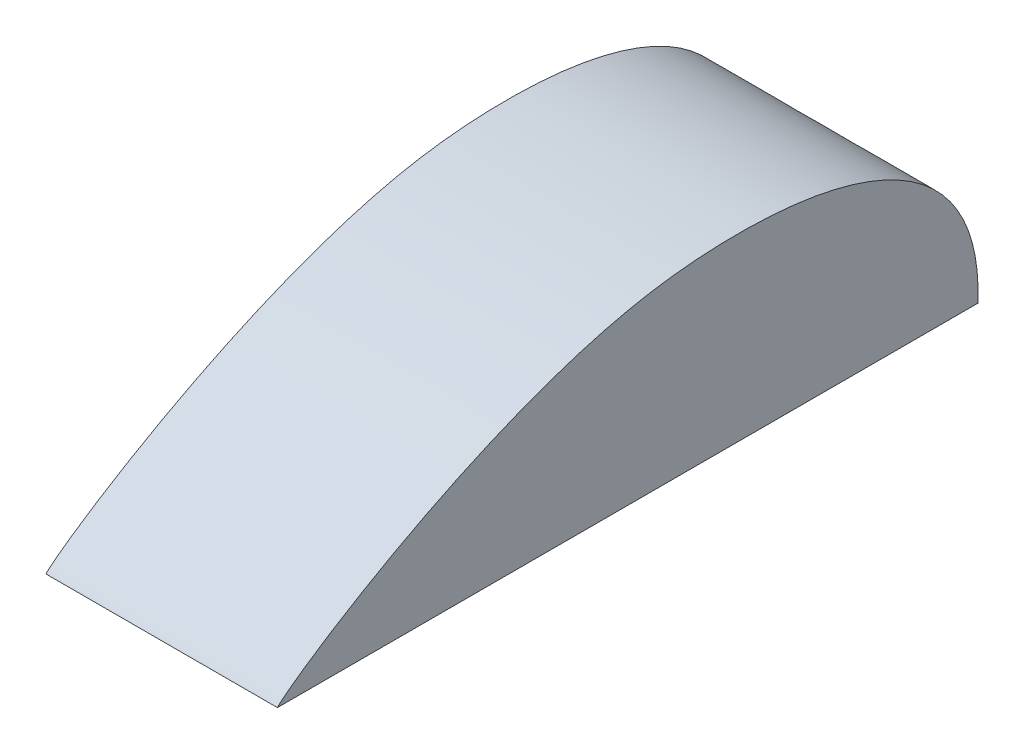
from build123d import *

# Parameters (mm, degrees)
BOSS_EXTRUDE1_DEPTH = 46.99


with BuildPart() as part:
    # Sketch1 → Boss-Extrude1 (new, symmetric)
    with BuildSketch(Plane(origin=(0, 0, 0), x_dir=(0, 0, -1), z_dir=(1, 0, 0))):
        with BuildLine():
            Line((-142.24, 0), (142.24, 0))
            add(Edge.make_bspline(
                [(-142.24, 0), (-138.322604019, 5.374802254), (-50.670881172, 65.139735668), (83.419079783, 78.198395312), (144.250976284, 56.590482324), (142.24, 0)],
                knots=[0, 0, 0, 0, 0.497311356, 0.584327889, 1, 1, 1, 1], degree=3))
        make_face()
    extrude(amount=BOSS_EXTRUDE1_DEPTH, both=True)


solid = part.part
